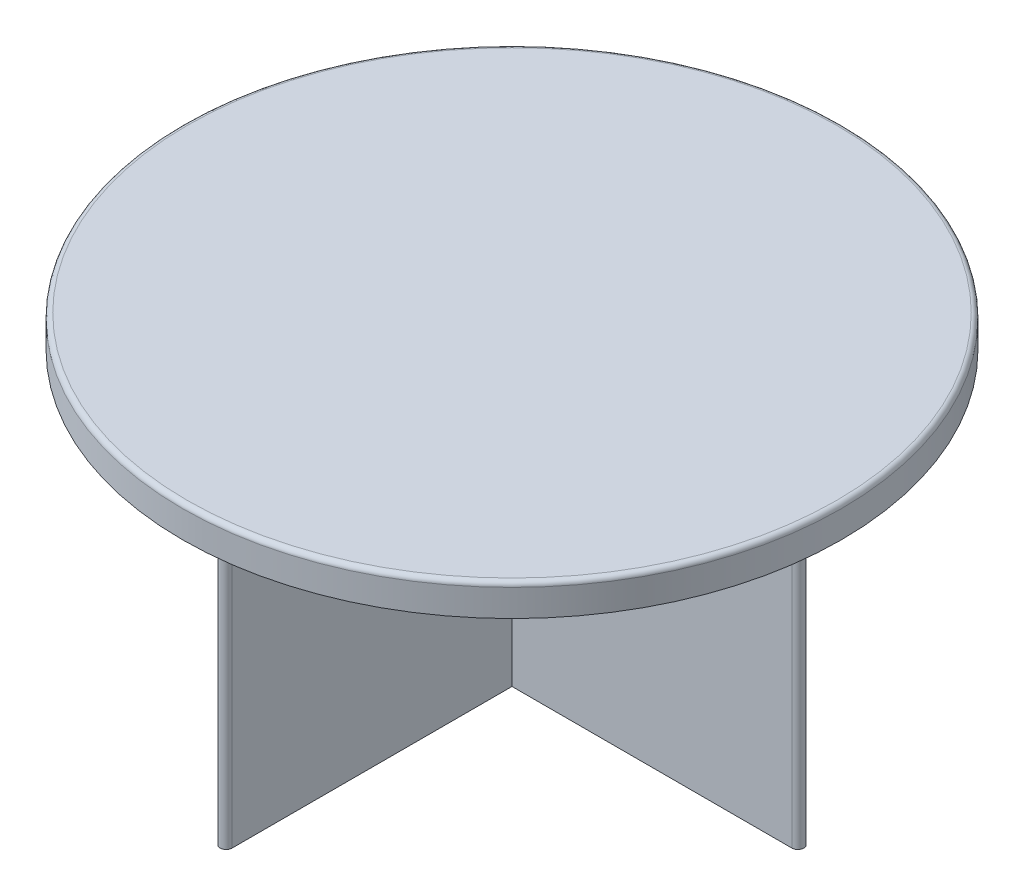
from build123d import *

# Parameters (mm, degrees)
SKETCH1_R           = 527.05
BOSS_EXTRUDE1_DEPTH = 50.8
FILLET1_R           = 7.62
BOSS_EXTRUDE2_DEPTH = 457.2


with BuildPart() as part:
    # Sketch1 → Boss-Extrude1 (new body)
    with BuildSketch(Plane(origin=(0, 0, 0), x_dir=(1, 0, 0), z_dir=(0, 1, 0))):
        with Locations(Location((0, 0, 0), (0, 0, 270))):
            Circle(SKETCH1_R)
    extrude(amount=BOSS_EXTRUDE1_DEPTH)

    # Fillet1
    fillet1_edges = [part.edges().sort_by_distance(p)[0] for p in [
        (0, 50.8, -527.05),
    ]]
    fillet(fillet1_edges, radius=FILLET1_R)

    # Sketch2 → Boss-Extrude2 (add)
    with BuildSketch(Plane.XZ):
        with BuildLine():
            Line((-9.525, 457.2), (-9.525, -457.2))
            ThreePointArc((-9.525, -457.2), (0, -466.725), (9.525, -457.2))
            Line((9.525, -457.2), (9.525, 457.2))
            ThreePointArc((9.525, 457.2), (0, 466.725), (-9.525, 457.2))
        make_face()
        with BuildLine():
            Line((-457.2, -9.525), (457.2, -9.525))
            ThreePointArc((457.2, -9.525), (466.725, 0), (457.2, 9.525))
            Line((457.2, 9.525), (-457.2, 9.525))
            ThreePointArc((-457.2, 9.525), (-466.725, 0), (-457.2, -9.525))
        make_face()
    extrude(amount=BOSS_EXTRUDE2_DEPTH)


solid = part.part
